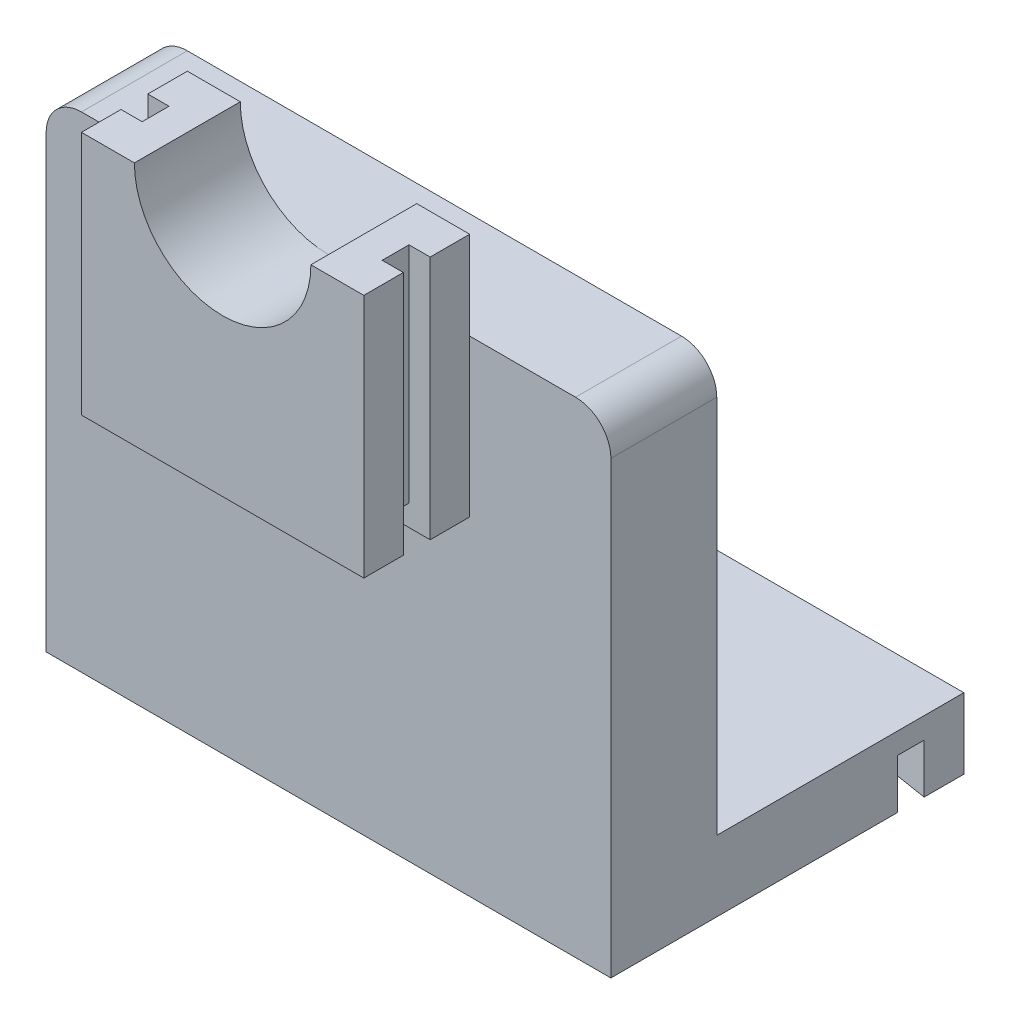
from build123d import *

# Parameters (mm, degrees)
BOSS_EXTRUDE4_DEPTH = 19.05
SKETCH4_W           = 101.6
SKETCH4_H           = 19.05
BOSS_EXTRUDE7_DEPTH = 12.7
SKETCH5_W           = 101.6
SKETCH5_H           = 12.7
BOSS_EXTRUDE8_DEPTH = 44.45
CUT_EXTRUDE1_DEPTH  = 8.89
BOSS_EXTRUDE9_DEPTH = 19.05
SKETCH9_W           = 4.826
SKETCH9_H           = 44.053125
CUT_EXTRUDE2_DEPTH  = 3.81
SKETCH10_W          = 46.99
SKETCH10_H          = 4.826
CUT_EXTRUDE3_DEPTH  = 3.81
SKETCH11_W          = 4.826
SKETCH11_H          = 40.243125
CUT_EXTRUDE4_DEPTH  = 3.81


with BuildPart() as part:
    # Sketch1 → Boss-Extrude4 (new body)
    with BuildSketch(Plane.XY):
        with BuildLine():
            Line((-109.851890308, -12.598485557), (-109.851890308, -18.948485557))
            Line((-109.851890308, -18.948485557), (-103.501890308, -18.948485557))
            Line((-103.501890308, -18.948485557), (-14.601890308, -18.948485557))
            Line((-14.601890308, -18.948485557), (-8.251890308, -18.948485557))
            Line((-8.251890308, -18.948485557), (-8.251890308, -12.598485557))
            Line((-8.251890308, -12.598485557), (-8.251890308, 49.314014443))
            ThreePointArc((-8.251890308, 49.314014443), (-10.111762247, 53.804142503), (-14.601890308, 55.664014443))
            Line((-14.601890308, 55.664014443), (-103.501890308, 55.664014443))
            ThreePointArc((-103.501890308, 55.664014443), (-107.992018368, 53.804142503), (-109.851890308, 49.314014443))
            Line((-109.851890308, 49.314014443), (-109.851890308, -12.598485557))
        make_face()
    extrude(amount=BOSS_EXTRUDE4_DEPTH)

    # Sketch4 → Boss-Extrude7 (add)
    with BuildSketch(Plane(origin=(0, -18.948485557, 0), x_dir=(-1, 0, 0), z_dir=(0, -1, 0))):
        with Locations((59.051890308, -9.525)):
            Rectangle(SKETCH4_W, SKETCH4_H)
    extrude(amount=BOSS_EXTRUDE7_DEPTH)

    # Sketch5 → Boss-Extrude8 (add)
    with BuildSketch(Plane(origin=(0, 0, 0), x_dir=(-1, 0, 0), z_dir=(0, 0, -1))):
        with Locations((59.051890308, -25.298485557)):
            Rectangle(SKETCH5_W, SKETCH5_H)
    extrude(amount=BOSS_EXTRUDE8_DEPTH)

    # Sketch7 → Cut-Extrude1 (cut)
    with BuildSketch(Plane.XZ.offset(31.648485557)):
        with BuildLine():
            Line((-26.362020963, -40.203870905), (-8.251890308, -37.30625))
            Line((-8.251890308, -37.30625), (-8.251890308, -32.54375))
            Line((-8.251890308, -32.54375), (-26.362020963, -29.646129095))
            ThreePointArc((-26.362020963, -29.646129095), (-24.177794705, -30.985152301), (-22.826560616, -33.161845648))
            Line((-22.826560616, -33.161845648), (-16.246378994, -34.925))
            Line((-16.246378994, -34.925), (-22.826560616, -36.688154352))
            ThreePointArc((-22.826560616, -36.688154352), (-24.177794705, -38.864847699), (-26.362020963, -40.203870905))
        make_face()
        with BuildLine():
            Line((-28.095640308, -40.48125), (-26.362020963, -40.203870905))
            ThreePointArc((-26.362020963, -40.203870905), (-24.177794705, -38.864847699), (-22.826560616, -36.688154352))
            Line((-22.826560616, -36.688154352), (-26.508140308, -37.674630657))
            ThreePointArc((-26.508140308, -37.674630657), (-27.27388984, -37.991814498), (-28.095640308, -38.1))
            ThreePointArc((-28.095640308, -38.1), (-31.270640308, -34.925), (-28.095640308, -31.75))
            ThreePointArc((-28.095640308, -31.75), (-27.27388984, -31.858185502), (-26.508140308, -32.175369343))
            Line((-26.508140308, -32.175369343), (-22.826560616, -33.161845648))
            ThreePointArc((-22.826560616, -33.161845648), (-24.177794705, -30.985152301), (-26.362020963, -29.646129095))
            Line((-26.362020963, -29.646129095), (-28.095640308, -29.36875))
            ThreePointArc((-28.095640308, -29.36875), (-33.651890308, -34.925), (-28.095640308, -40.48125))
        make_face()
        with BuildLine():
            Line((-109.851890308, -32.54375), (-109.851890308, -37.30625))
            Line((-109.851890308, -37.30625), (-91.741759653, -40.203870905))
            ThreePointArc((-91.741759653, -40.203870905), (-93.925985911, -38.864847699), (-95.277219999, -36.688154352))
            Line((-95.277219999, -36.688154352), (-101.857401622, -34.925))
            Line((-101.857401622, -34.925), (-95.277219999, -33.161845648))
            ThreePointArc((-95.277219999, -33.161845648), (-93.925985911, -30.985152301), (-91.741759653, -29.646129095))
            Line((-91.741759653, -29.646129095), (-109.851890308, -32.54375))
        make_face()
        with BuildLine():
            ThreePointArc((-95.277219999, -36.688154352), (-93.925985911, -38.864847699), (-91.741759653, -40.203870905))
            Line((-91.741759653, -40.203870905), (-90.008140308, -40.48125))
            ThreePointArc((-90.008140308, -40.48125), (-86.079278255, -38.853862053), (-84.451890308, -34.925))
            ThreePointArc((-84.451890308, -34.925), (-86.079278255, -30.996137947), (-90.008140308, -29.36875))
            Line((-90.008140308, -29.36875), (-91.741759653, -29.646129095))
            ThreePointArc((-91.741759653, -29.646129095), (-93.925985911, -30.985152301), (-95.277219999, -33.161845648))
            Line((-95.277219999, -33.161845648), (-91.595640308, -32.175369343))
            ThreePointArc((-91.595640308, -32.175369343), (-90.829890776, -31.858185502), (-90.008140308, -31.75))
            ThreePointArc((-90.008140308, -31.75), (-87.763076278, -32.67993597), (-86.833140308, -34.925))
            ThreePointArc((-86.833140308, -34.925), (-87.763076278, -37.17006403), (-90.008140308, -38.1))
            ThreePointArc((-90.008140308, -38.1), (-90.829890776, -37.991814498), (-91.595640308, -37.674630657))
            Line((-91.595640308, -37.674630657), (-95.277219999, -36.688154352))
        make_face()
    extrude(amount=-CUT_EXTRUDE1_DEPTH, mode=Mode.SUBTRACT)

    # Sketch3 → Boss-Extrude9 (add)
    with BuildSketch(Plane.XY.offset(19.05)):
        with BuildLine():
            Line((-84.451890308, 71.539014443), (-84.451890308, 55.664014443))
            Line((-84.451890308, 55.664014443), (-59.05189022, 55.664014443))
            ThreePointArc((-59.05189022, 55.664014443), (-70.277210428, 60.31369426), (-74.926890308, 71.539014443))
            Line((-74.926890308, 71.539014443), (-84.451890308, 71.539014443))
        make_face()
        Polygon((-84.451890308, 55.664014443), (-84.451890308, 27.485889443), (-33.651890308, 27.485889443), (-33.651890308, 55.664014443), (-59.05189022, 55.664014443), align=None)
        with BuildLine():
            Line((-59.05189022, 55.664014443), (-33.651890308, 55.664014443))
            Line((-33.651890308, 55.664014443), (-33.651890308, 71.539014443))
            Line((-33.651890308, 71.539014443), (-43.176890308, 71.539014443))
            ThreePointArc((-43.176890308, 71.539014443), (-47.826570125, 60.313694322), (-59.05189022, 55.664014443))
        make_face()
    extrude(amount=BOSS_EXTRUDE9_DEPTH)

    # Sketch9 → Cut-Extrude2 (cut)
    with BuildSketch(Plane(origin=(-33.651890308, 0, 0), x_dir=(0, 0, -1), z_dir=(1, 0, 0))):
        with Locations((-28.575, 49.512451943)):
            Rectangle(SKETCH9_W, SKETCH9_H)
    extrude(amount=-CUT_EXTRUDE2_DEPTH, mode=Mode.SUBTRACT)

    # Sketch10 → Cut-Extrude3 (cut)
    with BuildSketch(Plane.XZ.offset(-27.485889443)):
        with Locations((-60.956890308, 28.575)):
            Rectangle(SKETCH10_W, SKETCH10_H)
    extrude(amount=-CUT_EXTRUDE3_DEPTH, mode=Mode.SUBTRACT)

    # Sketch11 → Cut-Extrude4 (cut)
    with BuildSketch(Plane.ZY.offset(84.451890308)):
        with Locations((28.575, 51.417451943)):
            Rectangle(SKETCH11_W, SKETCH11_H)
    extrude(amount=-CUT_EXTRUDE4_DEPTH, mode=Mode.SUBTRACT)


solid = part.part
